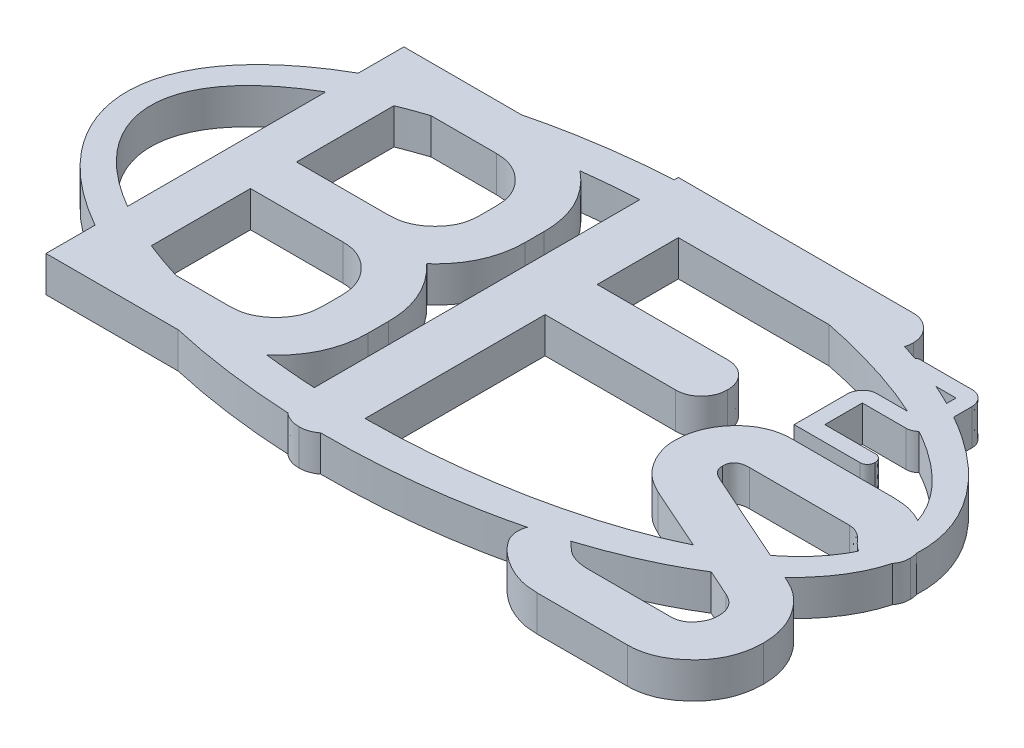
from build123d import *

# Parameters (mm, degrees)
BOSS_EXTRUDE1_DEPTH = 7.62
BOSS_EXTRUDE2_DEPTH = 7.62
SCALE1_SCALE        = 1.43


with BuildPart() as part:
    # Sketch1 → Boss-Extrude1 (new body)
    with BuildSketch(Plane(origin=(0, 0, 0), x_dir=(1, 0, 0), z_dir=(0, 1, 0))):
        with BuildLine():
            add(Edge.make_bspline(
                [(84.615713632, 0), (84.615713632, 42.310498293), (0, 42.310498293)],
                knots=[0, 0, 0, 1.570796327, 1.570796327, 1.570796327], degree=2, weights=[1, 0.707106781, 1]))
            Line((0, 42.310498293), (0, 34.944856909))
            add(Edge.make_bspline(
                [(-79.535713632, 0), (-79.535713632, -84.364347486), (56.240242456, -24.709745288), (192.016198543, 34.944856909), (0, 34.944856909)],
                knots=[0, 0, 0, 2.35619449, 2.35619449, 4.71238898, 4.71238898, 4.71238898], degree=2, weights=[1, 0.382683432, 1, 0.382683432, 1]))
            Line((-79.535713632, 0), (-84.615713632, 0))
            add(Edge.make_bspline(
                [(-84.615713632, 0), (-84.615713632, -42.310498293), (0, -42.310498293), (84.615713632, -42.310498293), (84.615713632, 0)],
                knots=[3.141592654, 3.141592654, 3.141592654, 4.71238898, 4.71238898, 6.283185307, 6.283185307, 6.283185307], degree=2, weights=[1, 0.707106781, 1, 0.707106781, 1]))
        make_face()
        with BuildLine():
            Line((0, 34.944856909), (0, 42.310498293))
            add(Edge.make_bspline(
                [(0, 42.310498293), (-84.615713632, 42.310498293), (-84.615713632, 0)],
                knots=[1.570796327, 1.570796327, 1.570796327, 3.141592654, 3.141592654, 3.141592654], degree=2, weights=[1, 0.707106781, 1]))
            Line((-84.615713632, 0), (-79.535713632, 0))
            add(Edge.make_bspline(
                [(0, 34.944856909), (-79.535713632, 34.944856909), (-79.535713632, 0)],
                knots=[4.71238898, 4.71238898, 4.71238898, 6.283185307, 6.283185307, 6.283185307], degree=2, weights=[1, 0.707106781, 1]))
        make_face()
    extrude(amount=BOSS_EXTRUDE1_DEPTH)

    # Sketch3 → Boss-Extrude2 (add)
    # profile 1 of 4: a face of its own
    with BuildSketch(Plane(origin=(0, 7.62, 0), x_dir=(1, 0, 0), z_dir=(0, 1, 0))):
        with BuildLine():
            Line((-14.397466217, -14.555921101), (-14.397466217, -18.859180029))
            add(Edge.make_bspline(
                [(-14.397466217, -18.859180029), (-14.412075217, -19.517853838), (-14.441044013, -20.823965678), (-14.724257008, -22.742856456), (-15.162788974, -24.589275161), (-15.782465551, -26.362542304), (-16.583687771, -28.068070924), (-17.573364026, -29.701609951), (-18.741703116, -31.256823084), (-20.053943875, -32.721890976), (-21.492235688, -34.063047471), (-23.028103244, -35.235861633), (-24.623591849, -36.25290542), (-26.313196243, -37.054672406), (-28.068798815, -37.684381306), (-29.895940607, -38.146568329), (-31.800161493, -38.427582146), (-33.094982908, -38.456012729), (-33.753626932, -38.470474672)],
                knots=[0, 0, 0, 0, 1.031665254, 2.045732174, 3.032773484, 4.00226151, 4.984049684, 5.98064323, 6.990028015, 8.028253762, 9.059344902, 10.067007453, 11.053128482, 12.018863216, 12.99131909, 13.971860038, 14.968334746, 16, 16, 16, 16], degree=3))
            Line((-33.753626932, -38.470474672), (-63.383180503, -38.470474672))
            Line((-63.383180503, -38.470474672), (-63.383180503, 37.729525328))
            Line((-63.383180503, 37.729525328), (-33.753626932, 37.729525328))
            add(Edge.make_bspline(
                [(-33.753626932, 37.729525328), (-33.094782485, 37.715966498), (-31.799567061, 37.689311336), (-29.900860481, 37.395808024), (-28.067523807, 36.982672294), (-26.309169602, 36.368246012), (-24.633420709, 35.557901975), (-23.027996574, 34.58315372), (-21.492519008, 33.442289363), (-20.060799389, 32.134970223), (-18.736445696, 30.720355249), (-17.579670822, 29.201294013), (-16.584535364, 27.61763779), (-15.775266979, 25.954058392), (-15.166537738, 24.210288223), (-14.725498331, 22.399058972), (-14.439202488, 20.514243126), (-14.411539327, 19.230534326), (-14.397466217, 18.577471756)],
                knots=[0, 0, 0, 0, 1.043455198, 2.051317689, 3.038820495, 4.019387899, 4.996159118, 5.984111652, 6.992454841, 8.023177139, 9.053350784, 10.059930293, 11.04493542, 12.013611194, 12.98569942, 13.966555063, 14.965523352, 16, 16, 16, 16], degree=3))
            Line((-14.397466217, 18.577471756), (-14.397466217, 14.563364614))
            add(Edge.make_bspline(
                [(-14.397466217, 14.563364614), (-14.41638998, 13.870499963), (-14.45365329, 12.506160766), (-14.76910169, 10.504261077), (-15.280628715, 8.582106297), (-16.002371776, 6.735728964), (-16.91911454, 4.953803448), (-18.073752912, 3.273967203), (-19.40463595, 1.654741032), (-20.425149029, 0.67417915), (-20.945903717, 0.173811042)],
                knots=[0, 0, 0, 0, 1.019485661, 2.00749778, 2.975242838, 3.942411858, 4.920467601, 5.918197128, 6.937682789, 8, 8, 8, 8], degree=3))
            add(Edge.make_bspline(
                [(-20.945903717, 0.173811042), (-20.424013306, -0.342939372), (-19.397033014, -1.359805134), (-18.077643804, -3.044830048), (-16.921999239, -4.77363266), (-16.001976195, -6.592738626), (-15.277268617, -8.478004817), (-14.77164376, -10.441175956), (-14.454145019, -12.476156237), (-14.416503052, -13.857385878), (-14.397466217, -14.555921101)],
                knots=[0, 0, 0, 0, 1.061060597, 2.087963866, 3.08850936, 4.063846261, 5.029207864, 6.003613919, 6.990359058, 8, 8, 8, 8], degree=3))
        make_face()
        with BuildLine():
            Line((-24.194609074, 14.512337828), (-24.194609074, 18.390373542))
            add(Edge.make_bspline(
                [(-24.194609074, 18.390373542), (-24.223427206, 19.023915555), (-24.280381406, 20.276004973), (-24.851102132, 22.065335393), (-25.761378551, 23.715158413), (-27.012144162, 25.163171702), (-28.493552314, 26.386245818), (-30.152581458, 27.290979184), (-31.96684054, 27.845705956), (-33.228088127, 27.903066508), (-33.872689432, 27.932382471)],
                knots=[0, 0, 0, 0, 1.005472038, 1.987146669, 2.956304749, 3.986723512, 5.012510979, 5.997496494, 6.976555923, 8, 8, 8, 8], degree=3))
            Line((-33.872689432, 27.932382471), (-53.586037646, 27.932382471))
            Line((-53.586037646, 27.932382471), (-53.586037646, 5.072382471))
            Line((-53.586037646, 5.072382471), (-33.872689432, 5.072382471))
            add(Edge.make_bspline(
                [(-33.872689432, 5.072382471), (-33.23940128, 5.102338829), (-31.989460737, 5.161464626), (-30.190933588, 5.716751878), (-28.528708145, 6.599549872), (-27.044488806, 7.805827615), (-25.798599537, 9.250729746), (-24.846496509, 10.86645207), (-24.30609738, 12.653358699), (-24.232218865, 13.885224371), (-24.194609074, 14.512337828)],
                knots=[0, 0, 0, 0, 1.012297524, 1.99800314, 2.985381287, 4.0124045, 5.042916158, 6.027574999, 6.995885438, 8, 8, 8, 8], degree=3))
        make_face(mode=Mode.SUBTRACT)
        with BuildLine():
            Line((-24.194609074, -18.808153244), (-24.194609074, -14.709001458))
            add(Edge.make_bspline(
                [(-24.194609074, -14.709001458), (-24.231556215, -14.042152926), (-24.303829782, -12.737707704), (-24.845742789, -10.855854709), (-25.769366012, -9.140411861), (-27.032452016, -7.633641635), (-28.498107067, -6.340386475), (-30.169122392, -5.395513547), (-31.994316784, -4.831227919), (-33.262116245, -4.760646372), (-33.906707289, -4.724760386)],
                knots=[0, 0, 0, 0, 1.034915229, 2.024433076, 3.013362917, 4.039472758, 5.063464099, 6.033469471, 7.000151045, 8, 8, 8, 8], degree=3))
            Line((-33.906707289, -4.724760386), (-53.586037646, -4.724760386))
            Line((-53.586037646, -4.724760386), (-53.586037646, -28.673331815))
            Line((-53.586037646, -28.673331815), (-33.906707289, -28.673331815))
            add(Edge.make_bspline(
                [(-33.906707289, -28.673331815), (-33.267565013, -28.63789336), (-32.010447889, -28.568190118), (-30.202437942, -27.996613404), (-28.532297182, -27.071591866), (-27.043085238, -25.805214508), (-25.796003083, -24.288196867), (-24.845131419, -22.604345155), (-24.304600717, -20.745430344), (-24.231818889, -19.463527775), (-24.194609074, -18.808153244)],
                knots=[0, 0, 0, 0, 0.998381792, 1.963698685, 2.936527885, 3.969050543, 5.00271592, 5.995366085, 6.97512803, 8, 8, 8, 8], degree=3))
        make_face(mode=Mode.SUBTRACT)
    # profile 2 of 4: a face of its own
    with BuildSketch(Plane(origin=(0, 7.62, 0), x_dir=(1, 0, 0), z_dir=(0, 1, 0))):
        with BuildLine():
            Line((-10.076253767, -38.028893302), (-10.076253767, 42.875776341))
            Line((-10.076253767, 42.875776341), (39.927728376, 42.875776341))
            add(Edge.make_bspline(
                [(39.927728376, 42.875776341), (40.276844467, 42.858370671), (40.976202545, 42.823503198), (41.991381771, 42.503872553), (42.931158745, 41.964140122), (43.783188541, 41.259275744), (44.517741968, 40.427795186), (45.042791959, 39.479325971), (45.398832343, 38.46066166), (45.42674316, 37.74474013), (45.44088909, 37.381892412)],
                knots=[0, 0, 0, 0, 0.972515176, 1.948166706, 2.9357758, 3.98050755, 5.023082354, 6.010691447, 6.991766502, 8, 8, 8, 8], degree=3))
            add(Edge.make_bspline(
                [(45.44088909, 37.381892412), (45.424935505, 37.013192131), (45.39354594, 36.287753851), (45.063652621, 35.238822444), (44.541936846, 34.268128541), (43.822060121, 33.413205968), (42.998897139, 32.67216013), (42.038529119, 32.174623562), (41.026534877, 31.8130573), (40.310108665, 31.786040559), (39.947005161, 31.772347769)],
                knots=[0, 0, 0, 0, 1.01424512, 1.995583599, 3.002834378, 4.035499497, 5.066032582, 6.033667922, 7.003411579, 8, 8, 8, 8], degree=3))
            Line((39.947005161, 31.772347769), (1.027174804, 31.772347769))
            Line((1.027174804, 31.772347769), (1.027174804, 14.500347769))
            Line((1.027174804, 14.500347769), (28.84357659, 14.500347769))
            add(Edge.make_bspline(
                [(28.84357659, 14.500347769), (29.212238921, 14.484326988), (29.937602532, 14.45280521), (30.973239302, 14.128226564), (31.926423961, 13.61577337), (32.757148965, 12.906196755), (33.458255788, 12.061222176), (33.961178019, 11.10191005), (34.29249324, 10.056036021), (34.322222527, 9.323897262), (34.337460519, 8.948633484)],
                knots=[0, 0, 0, 0, 1.015962941, 1.998963508, 2.968237726, 3.988999178, 4.998424523, 5.983347518, 6.966348085, 8, 8, 8, 8], degree=3))
            add(Edge.make_bspline(
                [(34.337460519, 8.948633484), (34.322222527, 8.573369705), (34.29249324, 7.841230946), (33.961178019, 6.795356917), (33.458255788, 5.836044791), (32.757148965, 4.991070212), (31.926423961, 4.281493598), (30.973239302, 3.769040403), (29.937602532, 3.444461757), (29.212238921, 3.412939979), (28.84357659, 3.396919198)],
                knots=[0, 0, 0, 0, 1.033651915, 2.016652482, 3.001575477, 4.011000822, 5.031762274, 6.001036492, 6.984037059, 8, 8, 8, 8], degree=3))
            Line((28.84357659, 3.396919198), (1.027174804, 3.396919198))
            Line((1.027174804, 3.396919198), (1.027174804, -38.067446874))
            add(Edge.make_bspline(
                [(1.027174804, -38.067446874), (1.011462553, -38.429909239), (0.980545805, -39.143120673), (0.649611381, -40.162658599), (0.149139588, -41.110943913), (-0.575001775, -41.921924906), (-1.405699351, -42.62899671), (-2.377139367, -43.103302843), (-3.416334146, -43.440729645), (-4.14900366, -43.46948491), (-4.524539481, -43.484223659)],
                knots=[0, 0, 0, 0, 1.005363169, 1.978237127, 2.954392289, 3.968779448, 4.985370772, 5.969031165, 6.95901012, 8, 8, 8, 8], degree=3))
            add(Edge.make_bspline(
                [(-4.524539481, -43.484223659), (-4.900055065, -43.469467749), (-5.632685097, -43.440679003), (-6.672164288, -43.103493381), (-7.642529794, -42.628276066), (-8.481138397, -41.921535347), (-9.192327731, -41.093001369), (-9.699625936, -40.144174553), (-10.031356179, -39.117455749), (-10.061038568, -38.397792732), (-10.076253767, -38.028893302)],
                knots=[0, 0, 0, 0, 1.03691572, 2.023020159, 3.002830764, 4.015443418, 5.039427973, 6.011762721, 6.980829108, 8, 8, 8, 8], degree=3))
        make_face()
    # profile 3 of 4: a face of its own
    with BuildSketch(Plane(origin=(0, 7.62, 0), x_dir=(1, 0, 0), z_dir=(0, 1, 0))):
        with BuildLine():
            Line((50.254989341, 6.751808076), (71.975391127, 6.751808076))
            add(Edge.make_bspline(
                [(71.975391127, 6.751808076), (72.800613213, 6.710845654), (74.420939502, 6.630415803), (76.781678424, 6.043939175), (78.966861521, 5.00998375), (80.937396617, 3.660253891), (82.601946617, 2.140858045), (83.862810483, 0.592630544), (84.68206522, -0.976465952), (84.785196686, -2.056512873), (84.834141127, -2.569084781)],
                knots=[0, 0, 0, 0, 1.150813513, 2.259626129, 3.367253242, 4.505851765, 5.580627064, 6.498448001, 7.287388947, 8, 8, 8, 8], degree=3))
            add(Edge.make_bspline(
                [(84.834141127, -2.569084781), (84.82084994, -2.911440186), (84.795125742, -3.574046059), (84.50887727, -4.511136347), (84.058305213, -5.355816075), (83.427383329, -6.068303711), (82.71258104, -6.663796593), (81.922282444, -7.079565048), (81.098615011, -7.351674719), (80.527283248, -7.383642787), (80.241730412, -7.399620496)],
                knots=[0, 0, 0, 0, 1.107712366, 2.143902821, 3.148243679, 4.191920452, 5.211978601, 6.150281752, 7.075506867, 8, 8, 8, 8], degree=3))
            add(Edge.make_bspline(
                [(80.241730412, -7.399620496), (79.868950973, -7.374378975), (79.123044597, -7.323872404), (78.050261971, -6.872853198), (77.028379438, -6.182905493), (76.143695498, -5.226455995), (75.277654411, -4.274382211), (74.305741724, -3.573468395), (73.29847577, -3.128739068), (72.603066554, -3.072642476), (72.264542912, -3.045334781)],
                knots=[0, 0, 0, 0, 0.950619791, 1.902125734, 2.936799471, 4.086360026, 5.22570288, 6.224632004, 7.135754856, 8, 8, 8, 8], degree=3))
            Line((72.264542912, -3.045334781), (50.969364341, -3.045334781))
            add(Edge.make_bspline(
                [(50.969364341, -3.045334781), (50.724731181, -3.047858316), (50.259410242, -3.052658374), (49.612767281, -3.195088836), (49.060041446, -3.395442224), (48.591395623, -3.667284651), (48.248453918, -4.054036472), (48.004769918, -4.515602435), (47.846310287, -5.053606542), (47.830867786, -5.442385516), (47.822712555, -5.647700853)],
                knots=[0, 0, 0, 0, 1.255682616, 2.388455495, 3.385383035, 4.275916262, 5.143214182, 6.004605349, 6.946226124, 8, 8, 8, 8], degree=3))
            add(Edge.make_bspline(
                [(47.822712555, -5.647700853), (47.846697693, -5.937032972), (47.894653933, -6.515527893), (48.367144224, -7.304904993), (49.121735095, -7.944904309), (49.747079346, -8.242423032), (50.084900055, -8.403147281)],
                knots=[0, 0, 0, 0, 0.908348835, 1.816166108, 2.820258902, 4, 4, 4, 4], degree=3))
            Line((50.084900055, -8.403147281), (75.870435769, -19.901182996))
            add(Edge.make_bspline(
                [(75.870435769, -19.901182996), (76.505838343, -20.210148681), (77.776889978, -20.828199906), (79.482006666, -22.120701298), (81.034149817, -23.642957788), (82.36016648, -25.428532497), (83.466658877, -27.376364279), (84.25588459, -29.470378167), (84.753788937, -31.664937475), (84.807137554, -33.171147712), (84.834141127, -33.933549067)],
                knots=[0, 0, 0, 0, 0.961677452, 1.92372796, 2.902571599, 3.918736947, 4.947041893, 5.948116966, 6.961394387, 8, 8, 8, 8], degree=3))
            add(Edge.make_bspline(
                [(84.834141127, -33.933549067), (84.821447387, -34.444473528), (84.796518639, -35.44785843), (84.589055892, -36.918704526), (84.241466272, -38.321975703), (83.788374629, -39.679423936), (83.172423691, -40.972608003), (82.412316903, -42.199477963), (81.548268718, -43.387205759), (80.531826329, -44.475757518), (79.432393739, -45.460278241), (78.316821759, -46.367508289), (77.127623337, -47.089429052), (75.926067175, -47.717674185), (74.668902015, -48.169414886), (73.385554835, -48.518738457), (72.061447584, -48.725382534), (71.16531639, -48.752007058), (70.716730412, -48.765334781)],
                knots=[0, 0, 0, 0, 1.080739382, 2.122422513, 3.134961872, 4.136497371, 5.145334562, 6.157589619, 7.186903584, 8.248091098, 9.301178605, 10.309159519, 11.28448751, 12.239462091, 13.173177643, 14.104346589, 15.051072493, 16, 16, 16, 16], degree=3))
            Line((70.716730412, -48.765334781), (51.513650055, -48.765334781))
            add(Edge.make_bspline(
                [(51.513650055, -48.765334781), (50.69902053, -48.732485006), (49.070236853, -48.666804625), (46.68941265, -48.035370258), (44.391460929, -47.057908284), (42.290867823, -45.722588181), (40.468198912, -44.237109654), (39.122214969, -42.68900553), (38.206637642, -41.148877712), (38.08368992, -40.07238659), (38.025569698, -39.563504424)],
                knots=[0, 0, 0, 0, 1.110232276, 2.219816682, 3.339936034, 4.508390219, 5.607556781, 6.535346419, 7.307624493, 8, 8, 8, 8], degree=3))
            add(Edge.make_bspline(
                [(38.025569698, -39.563504424), (38.042257213, -39.250148898), (38.075588414, -38.624260844), (38.333306199, -37.718505772), (38.781006941, -36.878699484), (39.365483177, -36.107748115), (40.09098159, -35.435335042), (40.953540983, -34.953535009), (41.920933964, -34.675270824), (42.593488209, -34.634817598), (42.941150055, -34.61390621)],
                knots=[0, 0, 0, 0, 0.968546241, 1.934548692, 2.883688364, 3.89738657, 4.915474739, 5.920488514, 6.925043135, 8, 8, 8, 8], degree=3))
            add(Edge.make_bspline(
                [(42.941150055, -34.61390621), (43.245488468, -34.643515251), (43.895760638, -34.706780137), (44.856680435, -35.155342976), (45.842238396, -35.850813315), (46.77884104, -36.827075246), (47.87755356, -37.808544441), (49.286979981, -38.485883531), (50.905590688, -38.903393332), (52.060729141, -38.945810041), (52.670257198, -38.968191924)],
                knots=[0, 0, 0, 0, 0.664176781, 1.419129686, 2.281992927, 3.289960229, 4.371981504, 5.480290529, 6.670433302, 8, 8, 8, 8], degree=3))
            Line((52.670257198, -38.968191924), (70.172444698, -38.968191924))
            add(Edge.make_bspline(
                [(70.172444698, -38.968191924), (70.510028815, -38.950997912), (71.166235123, -38.917575668), (72.094482661, -38.582745331), (72.95326762, -38.092679295), (73.668124791, -37.361284319), (74.270532183, -36.529387746), (74.729006321, -35.613674233), (74.988316141, -34.628063017), (75.020656232, -33.952004256), (75.036998269, -33.610379424)],
                knots=[0, 0, 0, 0, 1.004905328, 1.95336564, 2.918183802, 3.936711739, 4.980715508, 5.981038742, 6.979782027, 8, 8, 8, 8], degree=3))
            add(Edge.make_bspline(
                [(75.036998269, -33.610379424), (75.009106789, -33.098048682), (74.955473751, -32.112878528), (74.306452259, -30.774223447), (73.293842934, -29.662586264), (72.396967184, -29.184728243), (71.924364341, -28.932924067)],
                knots=[0, 0, 0, 0, 1.023491725, 1.968090955, 2.929298744, 4, 4, 4, 4], degree=3))
            Line((71.924364341, -28.932924067), (45.832667912, -17.315825853))
            add(Edge.make_bspline(
                [(45.832667912, -17.315825853), (45.23383999, -17.020124567), (44.065795516, -16.443344094), (42.491470068, -15.316688357), (41.141472307, -14.000737413), (40.017579052, -12.518063375), (39.145856221, -10.934951822), (38.509588348, -9.317236936), (38.086470828, -7.68773674), (38.045765885, -6.585695579), (38.025569698, -6.03890621)],
                knots=[0, 0, 0, 0, 1.105399233, 2.156137712, 3.192664937, 4.218705708, 5.22804767, 6.177213137, 7.095605034, 8, 8, 8, 8], degree=3))
            add(Edge.make_bspline(
                [(38.025569698, -6.03890621), (38.066358611, -5.200795552), (38.146784224, -3.548249343), (38.83665014, -1.174072674), (39.947514118, 1.031470881), (41.246288706, 2.652863385), (42.417629418, 3.857545444), (43.402684144, 4.610370706), (44.402072767, 5.29907284), (45.485198877, 5.807939742), (46.596083868, 6.257707), (47.773980083, 6.525071341), (48.994538666, 6.735084742), (49.828757548, 6.746152942), (50.254989341, 6.751808076)],
                knots=[0, 0, 0, 0, 1.531045353, 3.018841452, 4.485030049, 6.022809621, 6.800434105, 7.553874883, 8.287629594, 9.016084241, 9.738604333, 10.475871252, 11.22126897, 12, 12, 12, 12], degree=3))
        make_face()
    # profile 4 of 4: a face of its own
    with BuildSketch(Plane(origin=(0, 7.62, 0), x_dir=(1, 0, 0), z_dir=(0, 1, 0))):
        with BuildLine():
            Line((61.892764197, 9.624795581), (47.837719554, 9.624795581))
            Line((47.837719554, 9.624795581), (47.837719554, 20.850688439))
            add(Edge.make_bspline(
                [(47.837719554, 20.850688439), (47.847935058, 21.069282101), (47.867984832, 21.498311673), (48.046607457, 22.113267956), (48.32592369, 22.683787454), (48.726708717, 23.177588476), (49.186538731, 23.608056845), (49.718095416, 23.909768105), (50.29065952, 24.105233413), (50.689833363, 24.12764012), (50.893657054, 24.139081296)],
                knots=[0, 0, 0, 0, 1.05172577, 2.06420192, 3.062476446, 4.094120446, 5.113338204, 6.080699395, 7.019978539, 8, 8, 8, 8], degree=3))
            Line((50.893657054, 24.139081296), (60.174862411, 24.139081296))
            Line((60.174862411, 24.139081296), (60.174862411, 31.759081296))
            Line((60.174862411, 31.759081296), (49.351514197, 31.759081296))
            add(Edge.make_bspline(
                [(49.351514197, 31.759081296), (49.246803687, 31.763619315), (49.042557228, 31.772471094), (48.752752471, 31.868699399), (48.48961077, 32.020178136), (48.261564757, 32.228519592), (48.073747281, 32.479020619), (47.935610137, 32.759317041), (47.853992955, 33.068048941), (47.843251632, 33.281833488), (47.837719554, 33.391938439)],
                knots=[0, 0, 0, 0, 1.009821728, 1.969740308, 2.920032331, 3.929854059, 4.935528658, 5.933192445, 6.935536986, 8, 8, 8, 8], degree=3))
            add(Edge.make_bspline(
                [(47.837719554, 33.391938439), (47.843219984, 33.502069291), (47.853899858, 33.71590413), (47.935956644, 34.024276243), (48.072950668, 34.306957777), (48.268003559, 34.55307783), (48.49644968, 34.767875845), (48.767776049, 34.912129009), (49.061067468, 35.012535354), (49.267460413, 35.020616542), (49.374192768, 35.024795581)],
                knots=[0, 0, 0, 0, 1.056391843, 2.05113622, 3.041235335, 4.050276763, 5.052441632, 6.027121876, 6.979761983, 8, 8, 8, 8], degree=3))
            Line((49.374192768, 35.024795581), (60.333612411, 35.024795581))
            add(Edge.make_bspline(
                [(60.333612411, 35.024795581), (60.540898891, 35.014801719), (60.948261582, 34.995161621), (61.533474602, 34.812010147), (62.067170158, 34.506855214), (62.541314944, 34.097495381), (62.93421503, 33.607677154), (63.234691792, 33.066021773), (63.409363158, 32.468902489), (63.430040794, 32.055014701), (63.440576697, 31.844125939)],
                knots=[0, 0, 0, 0, 1.006311858, 1.97762008, 2.949189324, 3.979283943, 5.005885381, 5.98908594, 6.975376442, 8, 8, 8, 8], degree=3))
            Line((63.440576697, 31.844125939), (63.440576697, 24.093724153))
            add(Edge.make_bspline(
                [(63.440576697, 24.093724153), (63.430447983, 23.877025242), (63.410653997, 23.453542495), (63.231689058, 22.844766935), (62.946318109, 22.286012052), (62.547858983, 21.797402102), (62.076441615, 21.389743822), (61.546201884, 21.087529644), (60.965497853, 20.902789855), (60.561738524, 20.883289504), (60.356290982, 20.87336701)],
                knots=[0, 0, 0, 0, 1.047602039, 2.047270971, 3.046269042, 4.068485371, 5.08127142, 6.048690625, 7.007102289, 8, 8, 8, 8], degree=3))
            Line((60.356290982, 20.87336701), (51.103433839, 20.87336701))
            Line((51.103433839, 20.87336701), (51.103433839, 12.890509867))
            Line((51.103433839, 12.890509867), (61.915442768, 12.890509867))
            add(Edge.make_bspline(
                [(61.915442768, 12.890509867), (62.01639046, 12.885852214), (62.215082632, 12.876684702), (62.498693997, 12.779656776), (62.761293985, 12.62828783), (62.993381291, 12.419668957), (63.193697725, 12.172902119), (63.336125525, 11.890491105), (63.425888434, 11.582460895), (63.435591162, 11.367900093), (63.440576697, 11.257652724)],
                knots=[0, 0, 0, 0, 0.973992492, 1.917078851, 2.867941916, 3.89202663, 4.920677349, 5.927122584, 6.934897337, 8, 8, 8, 8], degree=3))
            add(Edge.make_bspline(
                [(63.440576697, 11.257652724), (63.43545064, 11.14747787), (63.425474431, 10.933058196), (63.337436434, 10.623165961), (63.18690041, 10.343927059), (62.988050068, 10.095596157), (62.754722781, 9.885248994), (62.48698789, 9.735753297), (62.197981962, 9.63857146), (61.995599078, 9.629436992), (61.892764197, 9.624795581)],
                knots=[0, 0, 0, 0, 1.057179543, 2.05745763, 3.064799103, 4.085797862, 5.102264581, 6.06182135, 7.015171794, 8, 8, 8, 8], degree=3))
        make_face()
    extrude(amount=-BOSS_EXTRUDE2_DEPTH)


with BuildPart() as part_1:
    # Scale1: scaled about (3.758936738, 3.81, 1.982744491)
    add(part.part.scale(SCALE1_SCALE).moved(Location((-1.616342797, -1.6383, -0.852580131))))


solid = part_1.part
